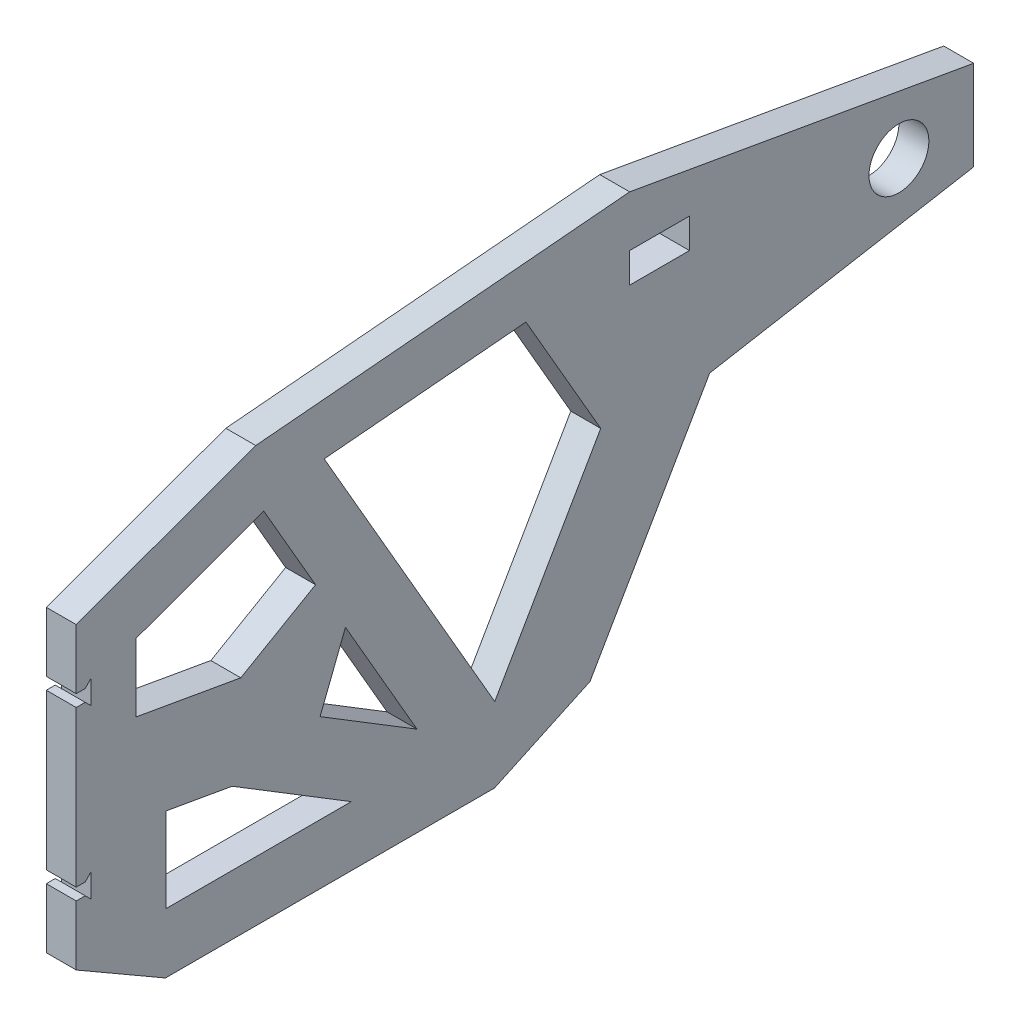
from build123d import *

# Parameters (mm, degrees)
ESQUISSE1_W                  = 300
ESQUISSE1_H                  = 150
BOSS_EXTRU_1_DEPTH           = 5
ESQUISSE2_OUTSIDE_W          = 369.112
ESQUISSE2_OUTSIDE_H          = 219.112
ENL_V_MAT_EXTRU_1_DEPTH      = 5
ENL_V_MAT_EXTRU_2_DEPTH      = 336.559234711
ENL_V_MAT_EXTRU_2_DEPTH_BACK = 336.559234711
ENL_V_MAT_EXTRU_3_DEPTH      = 336.559234711
ENL_V_MAT_EXTRU_3_DEPTH_BACK = 336.559234711
ENL_V_MAT_EXTRU_4_DEPTH      = 336.559234711
ENL_V_MAT_EXTRU_4_DEPTH_BACK = 336.559234711
ESQUISSE5_R                  = 10
ESQUISSE6_W                  = 20
ESQUISSE6_H                  = 10
ENL_V_MAT_EXTRU_5_DEPTH      = 49


with BuildPart() as part:
    # Esquisse1 → Boss.-Extru.1 (new, symmetric)
    with BuildSketch(Plane(origin=(0, 0, 0), x_dir=(0, 0, -1), z_dir=(1, 0, 0))):
        with Locations((150, 75)):
            Rectangle(ESQUISSE1_W, ESQUISSE1_H)
    extrude(amount=BOSS_EXTRU_1_DEPTH, both=True)

    # Esquisse2 outside → Enlèv. mat.-Extru.1 (cut, symmetric)
    with BuildSketch(Plane(origin=(0, 0, 0), x_dir=(0, 0, -1), z_dir=(1, 0, 0))):
        with Locations((150, 75)):
            Rectangle(ESQUISSE2_OUTSIDE_W, ESQUISSE2_OUTSIDE_H)
        Polygon((0, 117.225703003), (60, 139.063917059), (185, 150), (300, 129.722397219), (300, 99.722397219), (211.741963761, 84.160124165), (171.741963761, 14.878091862), (139.835792798, 0), (29.835792798, 0), (0, 17.225703003), align=None, mode=Mode.SUBTRACT)
    extrude(amount=ENL_V_MAT_EXTRU_1_DEPTH, both=True, mode=Mode.SUBTRACT)

    # Esquisse3 → Enlèv. mat.-Extru.2 (cut, two sides: drawn at the far end of the back side and taken through both)
    with BuildSketch(Plane(origin=(5, 0, 0), x_dir=(0, 0, -1), z_dir=(1, 0, 0)).offset(-ENL_V_MAT_EXTRU_2_DEPTH_BACK)):
        Polygon((20, 103.221552239), (20, 80.493304508), (55, 74.321860183), (80, 88.755616913), (62.679491924, 118.755616913), align=None)
        Polygon((90, 71.435108837), (113.922571241, 30), (81.508057782, 49.831775443), align=None)
        Polygon((82.886751346, 123.755616913), (139.903333355, 25), (175.32640016, 86.354551467), (150.32640016, 129.655821657), align=None)
        Polygon((91.944969354, 20), (30, 20), (30, 48.267236345), (52.117107943, 44.367393479), align=None)
    extrude(amount=ENL_V_MAT_EXTRU_2_DEPTH + ENL_V_MAT_EXTRU_2_DEPTH_BACK, mode=Mode.SUBTRACT)

    # Esquisse4 → Enlèv. mat.-Extru.3 (cut, two sides: drawn at the far end of the back side and taken through both)
    with BuildSketch(Plane(origin=(5, 0, 0), x_dir=(0, 0, -1), z_dir=(1, 0, 0)).offset(-ENL_V_MAT_EXTRU_3_DEPTH_BACK)):
        Polygon((0, 97.225703003), (3, 97.225703003), (5, 99.225703003), (5, 91.225703003), (3, 93.225703003), (0, 93.225703003), align=None)
        Polygon((3, 41.225703003), (0, 41.225703003), (0, 37.225703003), (3, 37.225703003), (5, 35.225703003), (5, 43.225703003), align=None)
    extrude(amount=ENL_V_MAT_EXTRU_3_DEPTH + ENL_V_MAT_EXTRU_3_DEPTH_BACK, mode=Mode.SUBTRACT)

    # Esquisse5 → Enlèv. mat.-Extru.4 (cut, two sides: drawn at the far end of the back side and taken through both)
    with BuildSketch(Plane.ZY.offset(5).offset(-ENL_V_MAT_EXTRU_4_DEPTH_BACK)):
        with Locations((-275, 114.722397219)):
            Circle(ESQUISSE5_R)
    extrude(amount=ENL_V_MAT_EXTRU_4_DEPTH + ENL_V_MAT_EXTRU_4_DEPTH_BACK, mode=Mode.SUBTRACT)

    # Esquisse6 → Enlèv. mat.-Extru.5 (cut)
    with BuildSketch(Plane(origin=(5, 0, 0), x_dir=(0, 0, -1), z_dir=(1, 0, 0))):
        with Locations((195, 128)):
            Rectangle(ESQUISSE6_W, ESQUISSE6_H)
    extrude(amount=-ENL_V_MAT_EXTRU_5_DEPTH, mode=Mode.SUBTRACT)


solid = part.part
